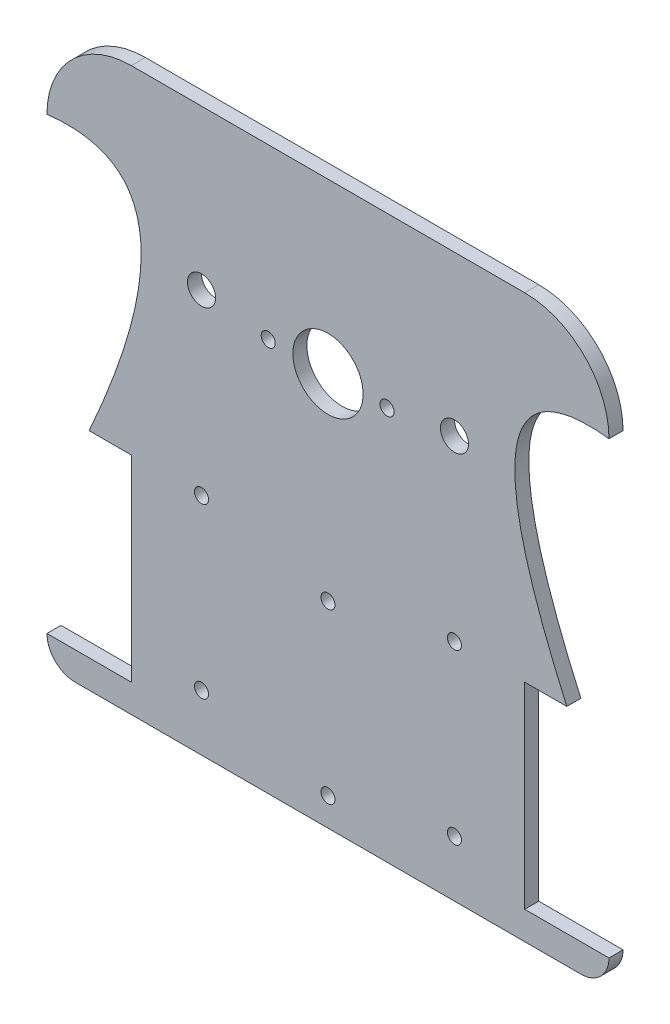
from build123d import *

# Parameters (mm, degrees)
BOSS_EXTRUDE1_DEPTH = 5
SKETCH2_W           = 30
SKETCH2_H           = 70
CUT_EXTRUDE1_DEPTH  = 5
CUT_EXTRUDE2_DEPTH  = 5
SKETCH5_R           = 2.5
SKETCH5_R_2         = 5
CUT_EXTRUDE3_DEPTH  = 5
SKETCH6_R           = 2.5
CUT_EXTRUDE4_DEPTH  = 5
SKETCH7_R           = 12.5
SKETCH7_R_2         = 2.5
CUT_EXTRUDE5_DEPTH  = 5


with BuildPart() as part:
    # Sketch1 → Boss-Extrude1 (new body)
    with BuildSketch(Plane.XY):
        with BuildLine():
            Line((-90, -100), (90, -100))
            ThreePointArc((90, -100), (97.071067812, -97.071067812), (100, -90))
            Line((100, -90), (100, 70))
            ThreePointArc((100, 70), (91.213203436, 91.213203436), (70, 100))
            Line((70, 100), (-70, 100))
            ThreePointArc((-70, 100), (-91.213203436, 91.213203436), (-100, 70))
            Line((-100, 70), (-100, -90))
            ThreePointArc((-100, -90), (-97.071067812, -97.071067812), (-90, -100))
        make_face()
    extrude(amount=BOSS_EXTRUDE1_DEPTH)

    # Sketch2 → Cut-Extrude1 (cut)
    with BuildSketch(Plane.XY.offset(5)):
        with Locations((85, -55)):
            Rectangle(SKETCH2_W, SKETCH2_H)
        with Locations((-85, -55)):
            Rectangle(SKETCH2_W, SKETCH2_H)
    extrude(amount=-CUT_EXTRUDE1_DEPTH, mode=Mode.SUBTRACT)

    # Sketch3 → Cut-Extrude2 (cut)
    with BuildSketch(Plane.XY.offset(5)):
        with BuildLine():
            Line((85, -20), (100, -20))
            Line((100, -20), (100, 70))
            add(Edge.make_bspline(
                [(100, 70), (41.562750789, 76.769648156), (85, -20)],
                knots=[0, 0, 0, 1, 1, 1], degree=2))
        make_face()
        with BuildLine():
            Line((-85, -20), (-100, -20))
            Line((-100, -20), (-100, 70))
            add(Edge.make_bspline(
                [(-100, 70), (-41.562750789, 76.769648156), (-85, -20)],
                knots=[0, 0, 0, 1, 1, 1], degree=2))
        make_face()
    extrude(amount=-CUT_EXTRUDE2_DEPTH, mode=Mode.SUBTRACT)

    # Sketch5 → Cut-Extrude3 (cut)
    with BuildSketch(Plane.XY.offset(5)):
        with Locations((45, -80)):
            Circle(SKETCH5_R)
        with Locations((-45, -80)):
            Circle(SKETCH5_R)
        with Locations(Location((45, -20, 0), (0, 0, 180))):
            Circle(SKETCH5_R)
        with Locations(Location((-45, -20, 0), (0, 0, 180))):
            Circle(SKETCH5_R)
        with Locations((-45, 43.350998567)):
            Circle(SKETCH5_R_2)
        with Locations(Location((45, 43.350998567, 0), (0, 0, 180))):
            Circle(SKETCH5_R_2)
        with Locations((0, -30)):
            Circle(SKETCH5_R)
    extrude(amount=-CUT_EXTRUDE3_DEPTH, mode=Mode.SUBTRACT)

    # Sketch6 → Cut-Extrude4 (cut)
    with BuildSketch(Plane.XY.offset(5)):
        with Locations((0, -90)):
            Circle(SKETCH6_R)
    extrude(amount=-CUT_EXTRUDE4_DEPTH, mode=Mode.SUBTRACT)

    # Sketch7 → Cut-Extrude5 (cut)
    with BuildSketch(Plane(origin=(0, 0, 0), x_dir=(-1, 0, 0), z_dir=(0, 0, -1))):
        with Locations((0, 40)):
            Circle(SKETCH7_R)
        with Locations((-21, 40)):
            Circle(SKETCH7_R_2)
        with Locations((21.26, 40)):
            Circle(SKETCH7_R_2)
    extrude(amount=-CUT_EXTRUDE5_DEPTH, mode=Mode.SUBTRACT)


solid = part.part
